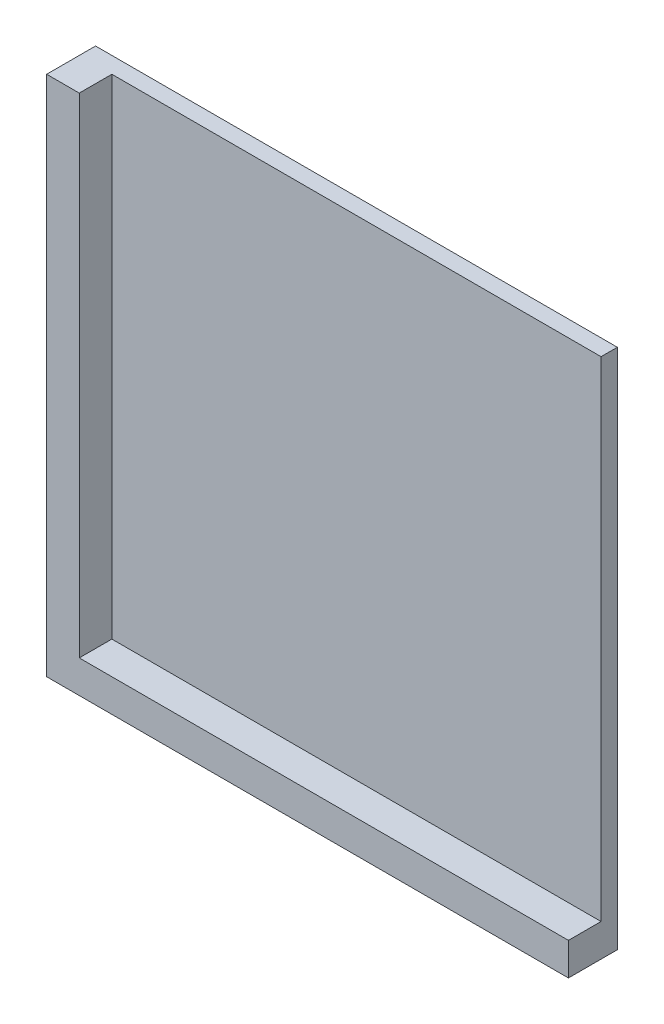
from build123d import *

# Parameters (mm, degrees)
BOSS_EXTRUDE1_DEPTH = 25.4
SKETCH1_3_W         = 406.4
SKETCH1_3_H         = 406.4
BOSS_EXTRUDE2_DEPTH = 12.7


with BuildPart() as part:
    # Sketch1 → Boss-Extrude1 (new body)
    with BuildSketch(Plane.XY):
        Polygon((-177.8, -177.8), (-177.8, 177.8), (-177.8, 203.2), (-203.2, 203.2), (-203.2, -203.2), (203.2, -203.2), (203.2, -177.8), (177.8, -177.8), align=None)
    extrude(amount=BOSS_EXTRUDE1_DEPTH)

    # Sketch1<3> → Boss-Extrude2 (add)
    with BuildSketch(Plane.XY):
        Rectangle(SKETCH1_3_W, SKETCH1_3_H)
    extrude(amount=-BOSS_EXTRUDE2_DEPTH)


solid = part.part
